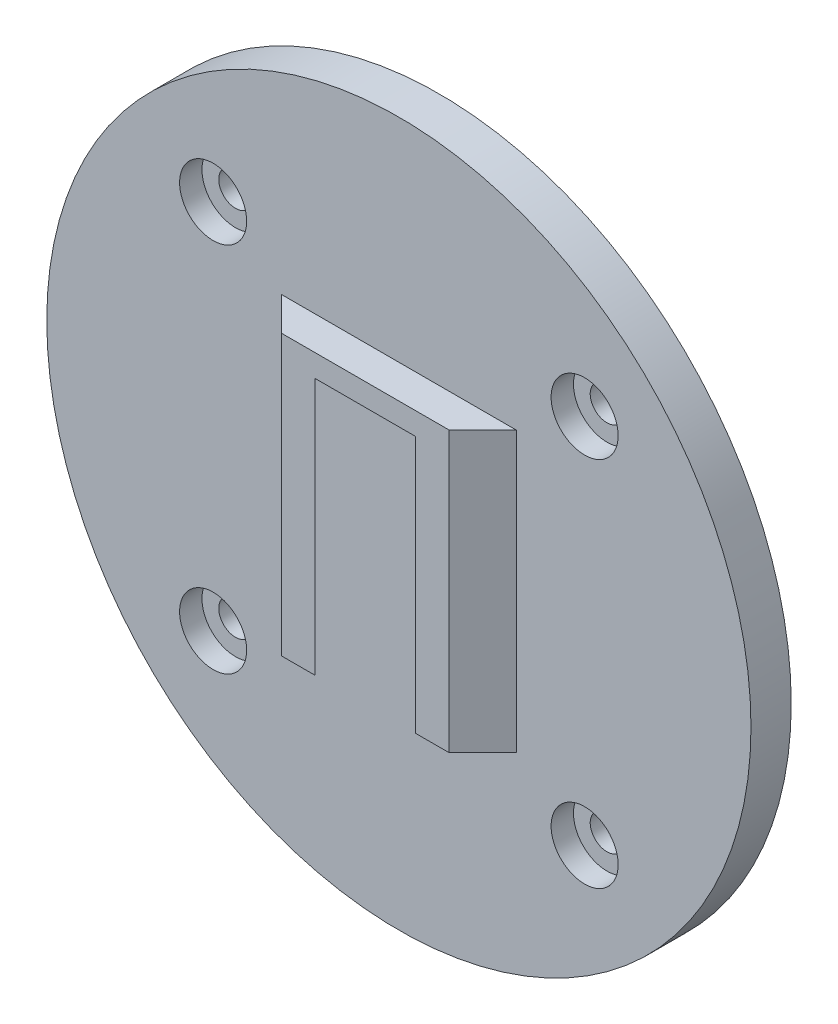
from build123d import *

# Parameters (mm, degrees)
CROQUIS1_R              = 31.5
SALIENTE_EXTRUIR1_DEPTH = 3.6
CROQUIS2_R              = 1.5
CORTAR_EXTRUIR1_DEPTH   = 3.6
CROQUIS3_R              = 3
CORTAR_EXTRUIR2_DEPTH   = 2
CROQUIS4_W              = 15
CROQUIS4_H              = 25
SALIENTE_EXTRUIR2_DEPTH = 3
SALIENTE_EXTRUIR4_DEPTH = 25
CORTAR_EXTRUIR6_DEPTH   = 23


with BuildPart() as part:
    # Croquis1 → Saliente-Extruir1 (new body)
    with BuildSketch(Plane.XY):
        with Locations((-75.665270593, 11.323426573)):
            Circle(CROQUIS1_R)
    extrude(amount=SALIENTE_EXTRUIR1_DEPTH)

    # Croquis2 → Cortar-Extruir1 (cut)
    with BuildSketch(Plane.XY.offset(3.6)):
        with Locations((-92.282279951, 27.940435931)):
            Circle(CROQUIS2_R)
        with Locations((-59.048261236, 27.940435931)):
            Circle(CROQUIS2_R)
        with Locations((-59.048261236, -5.293582784)):
            Circle(CROQUIS2_R)
        with Locations((-92.282279951, -5.293582784)):
            Circle(CROQUIS2_R)
    extrude(amount=-CORTAR_EXTRUIR1_DEPTH, mode=Mode.SUBTRACT)

    # Croquis3 → Cortar-Extruir2 (cut)
    with BuildSketch(Plane.XY.offset(3.6)):
        with Locations((-92.282279951, 27.940435931)):
            Circle(CROQUIS3_R)
        with Locations((-59.048261236, 27.940435931)):
            Circle(CROQUIS3_R)
        with Locations((-59.048261236, -5.293582784)):
            Circle(CROQUIS3_R)
        with Locations((-92.282279951, -5.293582784)):
            Circle(CROQUIS3_R)
    extrude(amount=-CORTAR_EXTRUIR2_DEPTH, mode=Mode.SUBTRACT)

    # Croquis4 → Saliente-Extruir2 (add)
    with BuildSketch(Plane.XY.offset(3.6)):
        with Locations((-75.665270593, 11.323426573)):
            Rectangle(CROQUIS4_W, CROQUIS4_H)
    extrude(amount=SALIENTE_EXTRUIR2_DEPTH)

    # Croquis7 → Saliente-Extruir4 (add)
    with BuildSketch(Plane.XZ.offset(1.176573427)):
        Polygon((-83.165270593, 6.6), (-86.165270593, 3.6), (-83.165270593, 3.6), align=None)
        Polygon((-68.165270593, 6.6), (-65.165270593, 3.6), (-68.165270593, 3.6), align=None)
    extrude(amount=-SALIENTE_EXTRUIR4_DEPTH)

    # Croquis8 → Cortar-Extruir6 (cut)
    with BuildSketch(Plane.XZ.offset(1.176573427)):
        Polygon((-83.165270593, 3.6), (-80.165270593, 6.6), (-71.165270593, 6.6), (-68.165270593, 3.6), align=None)
    extrude(amount=-CORTAR_EXTRUIR6_DEPTH, mode=Mode.SUBTRACT)


solid = part.part
